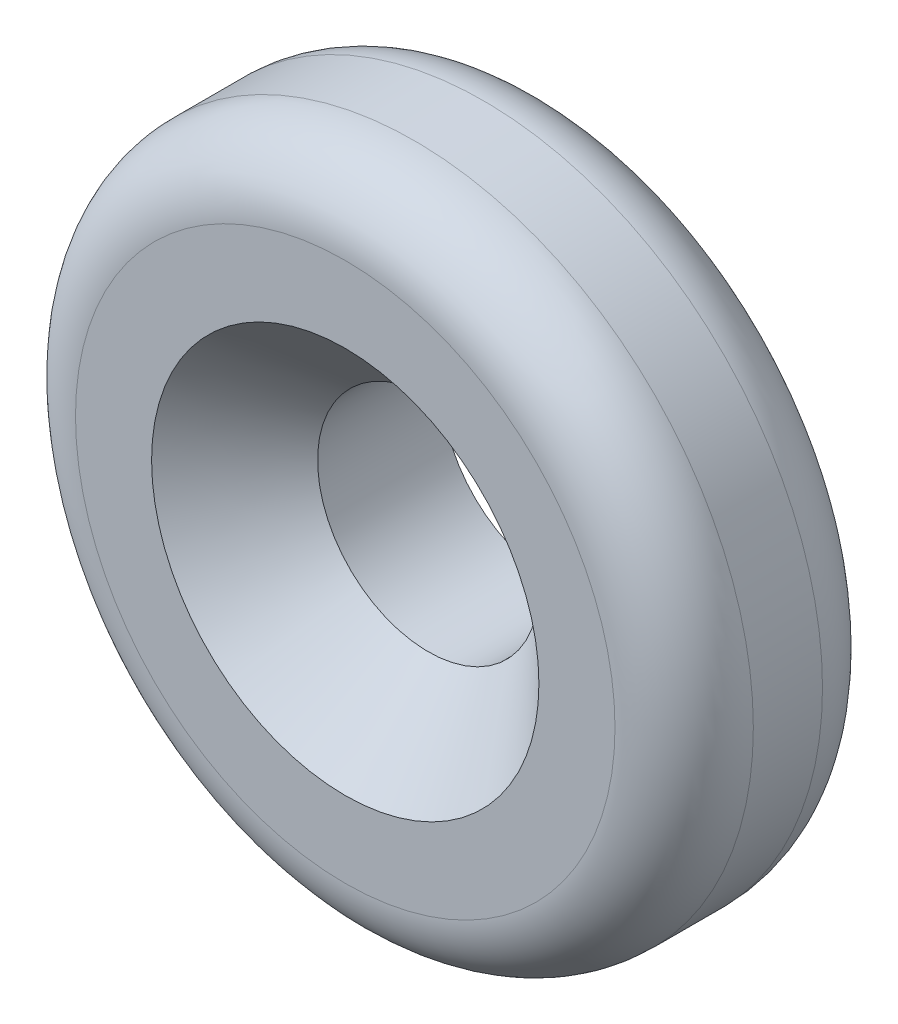
from build123d import *

# Parameters (mm, degrees)
SKETCH_1_R          = 4.9
EXTRUDE_1_DEPTH     = 3
SKETCH_2_R          = 1.6
CUT_EXTRUDE_1_DEPTH = 8.551158851
CHAMFER_1_SIZE      = 1.2
FILLET_1_R          = 1
FILLET_2_R          = 1


with BuildPart() as part:
    # 草图1 → 凸台-拉伸1 (new body)
    with BuildSketch(Plane.XY):
        Circle(SKETCH_1_R)
    extrude(amount=EXTRUDE_1_DEPTH)

    # 草图2 → 切除-拉伸1 (cut, through all)
    with BuildSketch(Plane.XY.offset(3)):
        Circle(SKETCH_2_R)
    extrude(amount=-CUT_EXTRUDE_1_DEPTH, mode=Mode.SUBTRACT)

    # 倒角1
    chamfer_1_edges = [part.edges().sort_by_distance(p)[0] for p in [
        (-1.6, 0, 3),
    ]]
    chamfer(chamfer_1_edges, length=CHAMFER_1_SIZE)

    # 圆角1
    fillet_1_edges = [part.edges().sort_by_distance(p)[0] for p in [
        (-4.9, 0, 3),
    ]]
    fillet(fillet_1_edges, radius=FILLET_1_R)

    # 圆角2
    fillet_2_edges = [part.edges().sort_by_distance(p)[0] for p in [
        (-4.9, 0, 0),
    ]]
    fillet(fillet_2_edges, radius=FILLET_2_R)


solid = part.part
